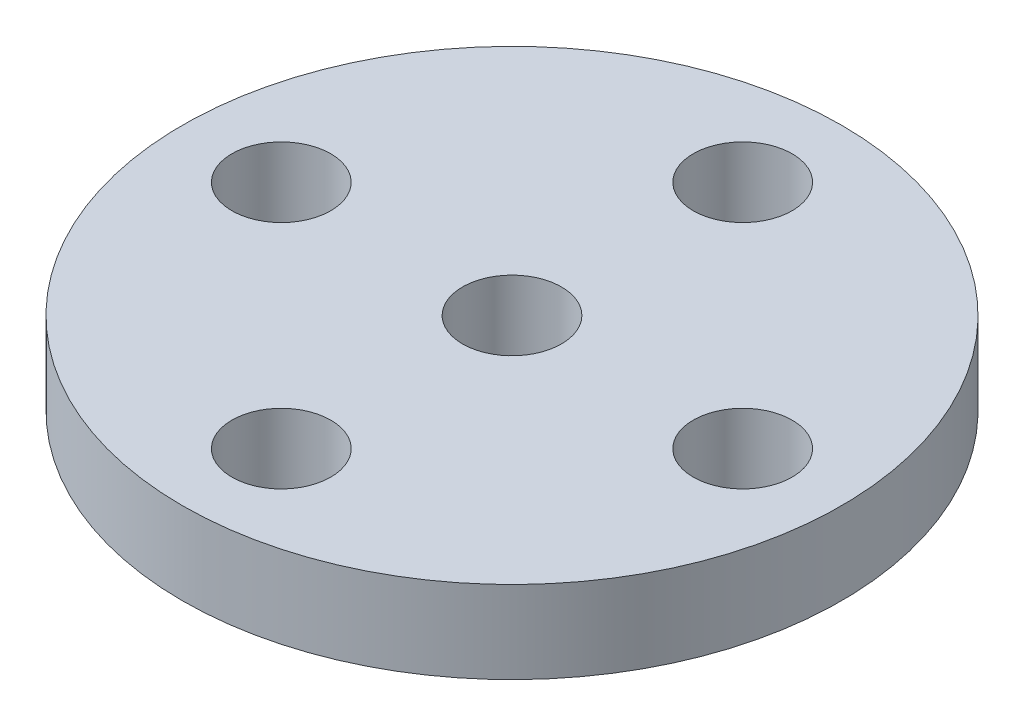
from build123d import *

# Parameters (mm, degrees)
SKETCH_1_R      = 10
SKETCH_1_R_2    = 1.5
EXTRUDE_1_DEPTH = 2.5


with BuildPart() as part:
    # 草图1 → 凸台-拉伸1 (new body)
    with BuildSketch(Plane(origin=(0, 0, 0), x_dir=(1, 0, 0), z_dir=(0, 1, 0))):
        with Locations(Location((0, 0, 0), (0, 0, 270))):
            Circle(SKETCH_1_R)
        with Locations(Location((0, 7, 0), (0, 0, 270))):
            Circle(SKETCH_1_R_2, mode=Mode.SUBTRACT)
        with Locations(Location((7, 0, 0), (0, 0, 270))):
            Circle(SKETCH_1_R_2, mode=Mode.SUBTRACT)
        with Locations(Location((0, 0, 0), (0, 0, 270))):
            Circle(SKETCH_1_R_2, mode=Mode.SUBTRACT)
        with Locations(Location((0, -7, 0), (0, 0, 90))):
            Circle(SKETCH_1_R_2, mode=Mode.SUBTRACT)
        with Locations(Location((-7, 0, 0), (0, 0, 90))):
            Circle(SKETCH_1_R_2, mode=Mode.SUBTRACT)
    extrude(amount=EXTRUDE_1_DEPTH)


solid = part.part
